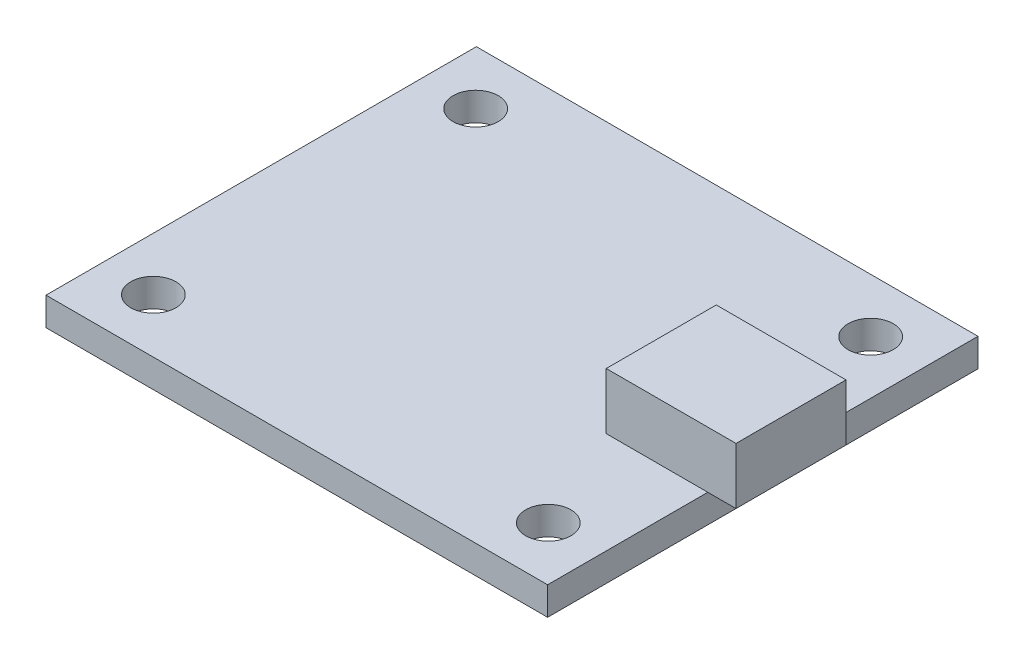
from build123d import *

# Parameters (mm, degrees)
SKETCH1_W           = 35.56
SKETCH1_H           = 30.51
BOSS_EXTRUDE1_DEPTH = 2
SKETCH2_R           = 1.6
CUT_EXTRUDE1_DEPTH  = 24.512622674
SKETCH3_W           = 9.2
SKETCH3_H           = 7.8
BOSS_EXTRUDE2_DEPTH = 4


with BuildPart() as part:
    # Sketch1 → Boss-Extrude1 (new body)
    with BuildSketch(Plane(origin=(0, 0, 0), x_dir=(1, 0, 0), z_dir=(0, 1, 0))):
        Rectangle(SKETCH1_W, SKETCH1_H)
    extrude(amount=BOSS_EXTRUDE1_DEPTH)

    # Sketch2 → Cut-Extrude1 (cut, through all)
    with BuildSketch(Plane(origin=(0, 2, 0), x_dir=(1, 0, 0), z_dir=(0, 1, 0))):
        with Locations(Location((-14, 11.425, 0), (0, 0, 270))):
            Circle(SKETCH2_R)
        with Locations(Location((14, 11.425, 0), (0, 0, 270))):
            Circle(SKETCH2_R)
        with Locations(Location((14, -11.425, 0), (0, 0, 270))):
            Circle(SKETCH2_R)
        with Locations(Location((-14, -11.425, 0), (0, 0, 270))):
            Circle(SKETCH2_R)
    extrude(amount=-CUT_EXTRUDE1_DEPTH, mode=Mode.SUBTRACT)

    # Sketch3 → Boss-Extrude2 (add)
    with BuildSketch(Plane(origin=(0, 2, 0), x_dir=(1, 0, 0), z_dir=(0, 1, 0))):
        with Locations((15.18, 0)):
            Rectangle(SKETCH3_W, SKETCH3_H)
    extrude(amount=BOSS_EXTRUDE2_DEPTH)


solid = part.part
